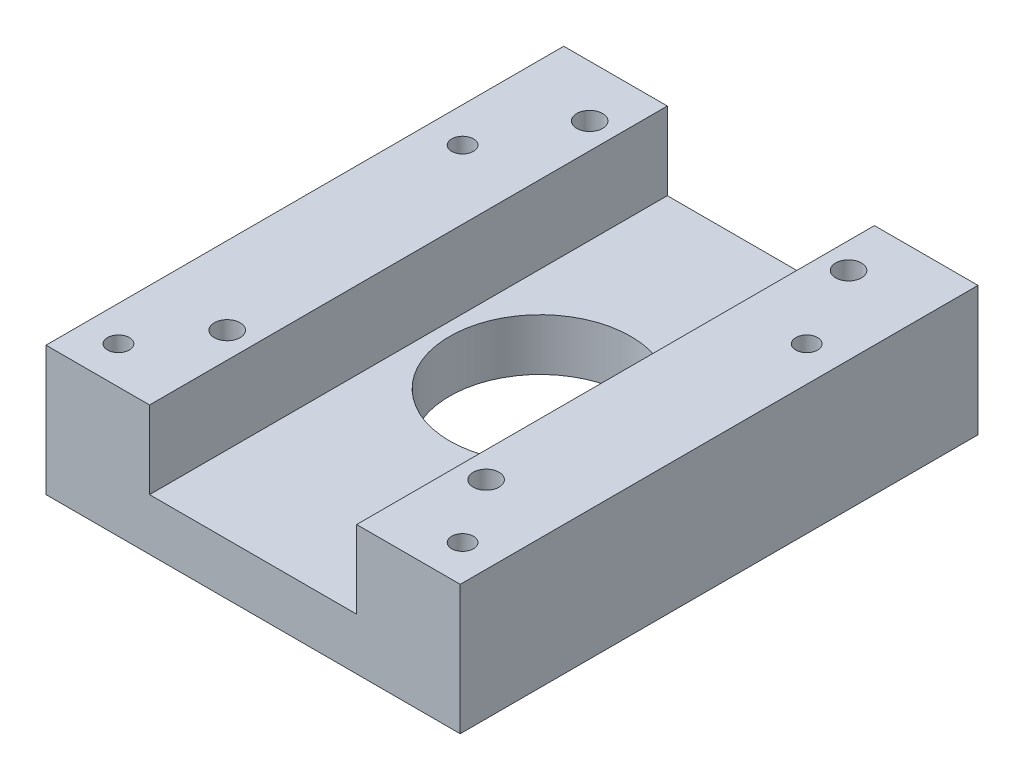
from build123d import *

# Parameters (mm, degrees)
EXTRUDE_1_DEPTH     = 80
EXTRUDE_4_DEPTH     = 20
HOLE_WIZARD_M5_1_D  = 4.2
HOLE_WIZARD_M6_1_D  = 5
SKETCH_2_R          = 17.5
CUT_EXTRUDE_2_DEPTH = 116.866302263


with BuildPart() as part:
    # 草图1 → 拉伸1 (new body)
    with BuildSketch(Plane.XY):
        Polygon((0, 0), (80, 0), (80, 25), (60, 25), (60, 10), (20, 10), (20, 25), (0, 25), align=None)
    extrude(amount=EXTRUDE_1_DEPTH)

    # 草图7 → 拉伸4 (add)
    with BuildSketch(Plane(origin=(0, 0, 0), x_dir=(-1, 0, 0), z_dir=(0, 0, -1))):
        Polygon((-80, 0), (-80, 25), (-60, 25), (-60, 10), (-20, 10), (-20, 25), (0, 25), (0, 0), align=None)
    extrude(amount=EXTRUDE_4_DEPTH)

    # M5 螺纹孔1 (through all)
    with Locations(Plane(origin=(73.234018716, 0, 72.779084328), x_dir=(0, 0, -1), z_dir=(0, -1, 0))):
        with Locations((0, 0), (0, -66.468037432), (66.468037432, -66.468037432), (66.468037432, 0)):
            Hole(HOLE_WIZARD_M5_1_D / 2)

    # M6 螺纹孔1 (through all)
    with Locations(Plane(origin=(0, 25, 0), x_dir=(-1, 0, 0), z_dir=(0, 1, 0))):
        with Locations((-15, -10), (-15, 60), (-65, -10), (-65, 60)):
            Hole(HOLE_WIZARD_M6_1_D / 2)

    # 草图2 → 拉伸2 (cut, through all)
    with BuildSketch(Plane(origin=(0, 0, 0), x_dir=(1, 0, 0), z_dir=(0, 1, 0))):
        with Locations(Location((40, -24.55, 0), (0, 0, 90))):
            Circle(SKETCH_2_R)
    extrude(amount=CUT_EXTRUDE_2_DEPTH, mode=Mode.SUBTRACT)


solid = part.part
